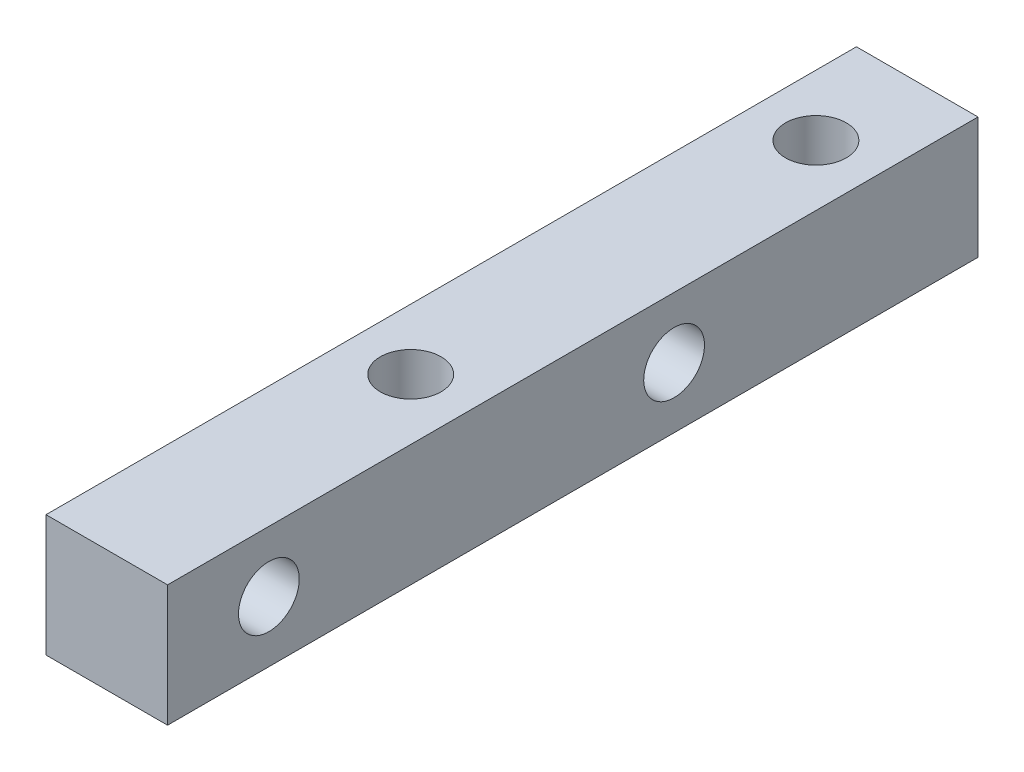
from build123d import *

# Parameters (mm, degrees)
SKETCH_1_W          = 6
SKETCH_1_H          = 6
EXTRUDE_1_DEPTH     = 20
CUT_EXTRUDE_1_REACH = 23.095
SKETCH_2_R          = 1.5
CUT_EXTRUDE_2_REACH = 23.095
SKETCH_3_R          = 1.5


with BuildPart() as part:
    # 草图1 → 凸台-拉伸1 (new, symmetric)
    with BuildSketch(Plane.XY):
        Rectangle(SKETCH_1_W, SKETCH_1_H)
    extrude(amount=EXTRUDE_1_DEPTH, both=True)

    # 草图2 → 切除-拉伸1 (cut, up to next)
    with BuildSketch(Plane(origin=(3, 0, 0), x_dir=(0, 0, -1), z_dir=(1, 0, 0)), mode=Mode.PRIVATE) as cut_extrude_1_sk1:
        with Locations(Location((-15, 0, 0), (0, 0, 90))):
            Circle(SKETCH_2_R)
    cut_extrude_1_tool1 = extrude(cut_extrude_1_sk1.sketch, amount=-CUT_EXTRUDE_1_REACH, mode=Mode.PRIVATE) & part.part
    # 草图2 → 切除-拉伸1 (cut, up to next)
    with BuildSketch(Plane(origin=(3, 0, 0), x_dir=(0, 0, -1), z_dir=(1, 0, 0)), mode=Mode.PRIVATE) as cut_extrude_1_sk2:
        with Locations(Location((5, 0, 0), (0, 0, 90))):
            Circle(SKETCH_2_R)
    cut_extrude_1_tool2 = extrude(cut_extrude_1_sk2.sketch, amount=-CUT_EXTRUDE_1_REACH, mode=Mode.PRIVATE) & part.part
    add(cut_extrude_1_tool1.solids().sort_by_distance((3, 0, 15))[0], mode=Mode.SUBTRACT)
    add(cut_extrude_1_tool2.solids().sort_by_distance((3, 0, -5))[0], mode=Mode.SUBTRACT)

    # 草图3 → 切除-拉伸2 (cut, up to next)
    with BuildSketch(Plane(origin=(0, 3, 0), x_dir=(1, 0, 0), z_dir=(0, 1, 0)), mode=Mode.PRIVATE) as cut_extrude_2_sk1:
        with Locations(Location((0, 15, 0), (0, 0, 270))):
            Circle(SKETCH_3_R)
    cut_extrude_2_tool1 = extrude(cut_extrude_2_sk1.sketch, amount=-CUT_EXTRUDE_2_REACH, mode=Mode.PRIVATE) & part.part
    # 草图3 → 切除-拉伸2 (cut, up to next)
    with BuildSketch(Plane(origin=(0, 3, 0), x_dir=(1, 0, 0), z_dir=(0, 1, 0)), mode=Mode.PRIVATE) as cut_extrude_2_sk2:
        with Locations(Location((0, -5, 0), (0, 0, 270))):
            Circle(SKETCH_3_R)
    cut_extrude_2_tool2 = extrude(cut_extrude_2_sk2.sketch, amount=-CUT_EXTRUDE_2_REACH, mode=Mode.PRIVATE) & part.part
    add(cut_extrude_2_tool1.solids().sort_by_distance((0, 3, -15))[0], mode=Mode.SUBTRACT)
    add(cut_extrude_2_tool2.solids().sort_by_distance((0, 3, 5))[0], mode=Mode.SUBTRACT)


solid = part.part
